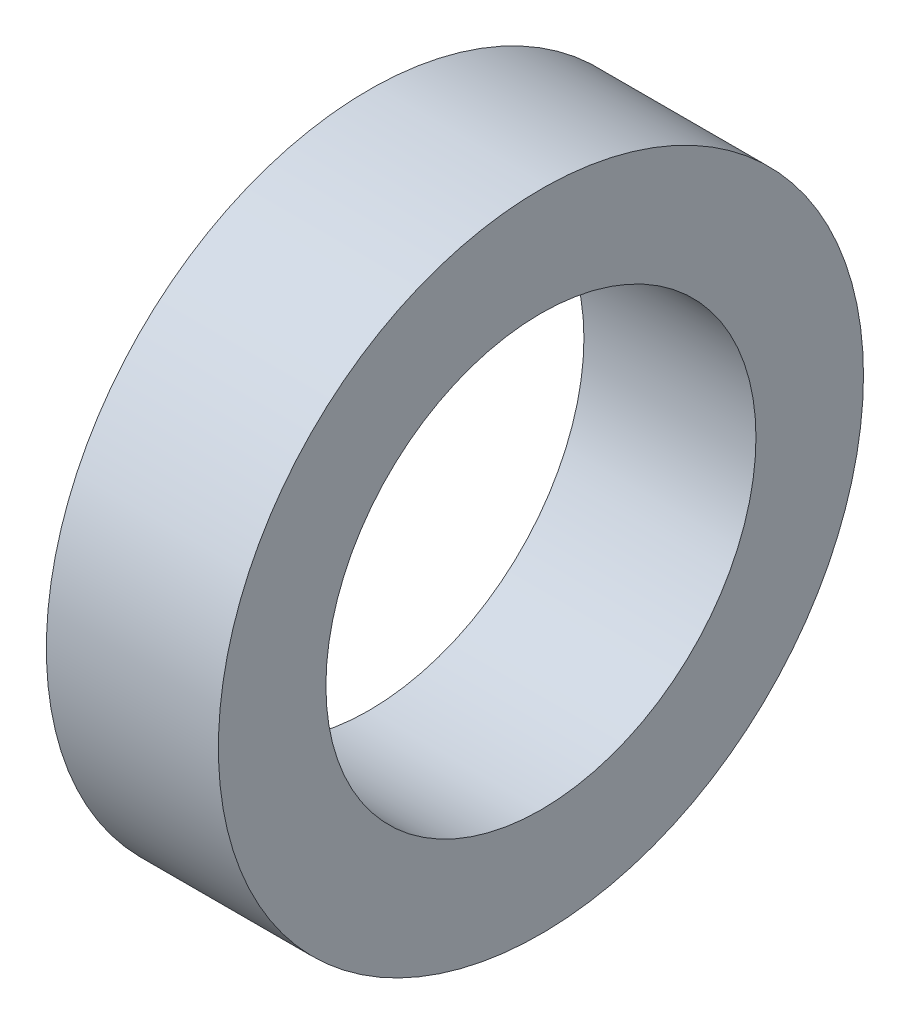
from build123d import *

# Parameters (mm, degrees)
SKETCH1_R           = 7.5
BOSS_EXTRUDE1_DEPTH = 4
SKETCH2_R           = 5
CUT_EXTRUDE1_DEPTH  = 12.335784049


with BuildPart() as part:
    # Sketch1 → Boss-Extrude1 (new body)
    with BuildSketch(Plane(origin=(0, 0, 0), x_dir=(0, 0, -1), z_dir=(1, 0, 0))):
        Circle(SKETCH1_R)
    extrude(amount=BOSS_EXTRUDE1_DEPTH)

    # Sketch2 → Cut-Extrude1 (cut, through all)
    with BuildSketch(Plane(origin=(4, 0, 0), x_dir=(0, 0, -1), z_dir=(1, 0, 0))):
        Circle(SKETCH2_R)
    extrude(amount=-CUT_EXTRUDE1_DEPTH, mode=Mode.SUBTRACT)


solid = part.part
